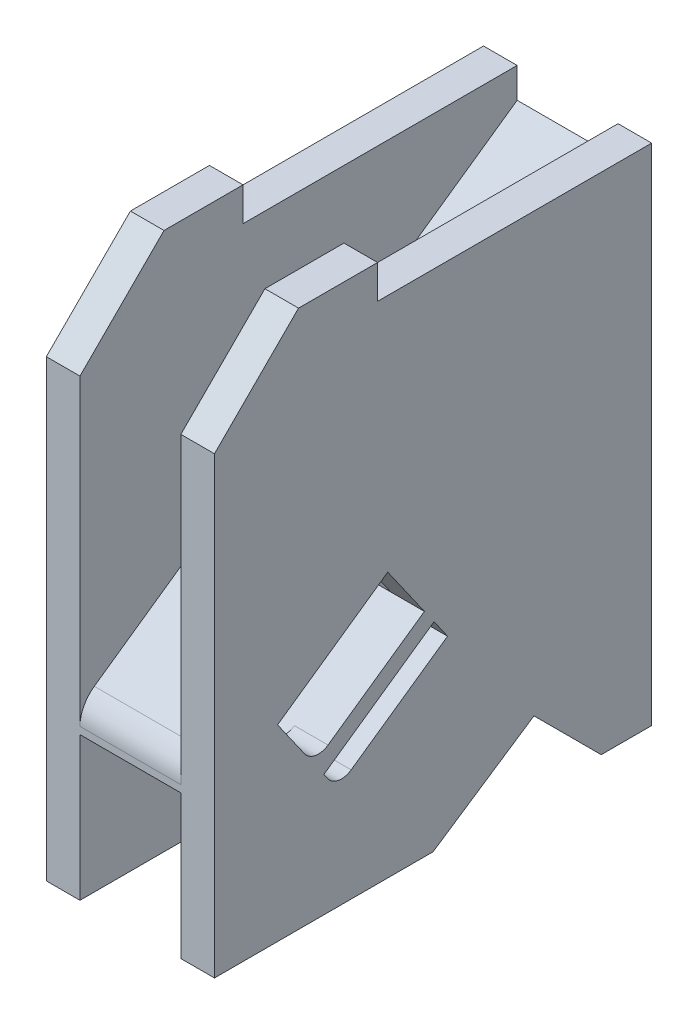
from build123d import *

# Parameters (mm, degrees)
SKETCH5_W           = 50.00000000000001
SKETCH5_H           = 130
BOSS_EXTRUDE1_DEPTH = 150
CUT_EXTRUDE1_START  = -25
CUT_EXTRUDE1_DEPTH  = 15
BOSS_EXTRUDE3_START = 30
BOSS_EXTRUDE3_DEPTH = 5
SKETCH10_R          = 8.750000000000018
CUT_EXTRUDE3_DEPTH  = 100
SKETCH18_W          = 48.5
SKETCH18_H          = 10
BOSS_EXTRUDE4_DEPTH = 10
BOSS_EXTRUDE5_START = 40
SKETCH18_2_W        = 48.5
SKETCH18_2_H        = 10
BOSS_EXTRUDE5_DEPTH = 10
CHAMFER1_SIZE       = 25
CUT_EXTRUDE5_DEPTH  = 70
FILLET1_R           = 5
CUT_EXTRUDE6_DEPTH  = 70
FILLET2_R           = 10


with BuildPart() as part:
    # Sketch5 → Boss-Extrude1 (new body)
    with BuildSketch(Plane(origin=(0, 0, 0), x_dir=(1, 0, 0), z_dir=(0, 1, 0))):
        with Locations((25.000000000000004, 65)):
            Rectangle(SKETCH5_W, SKETCH5_H)
    extrude(amount=BOSS_EXTRUDE1_DEPTH)

    # Sketch7 → Cut-Extrude1 (cut, symmetric)
    with BuildSketch(Plane(origin=(50, 0, 0), x_dir=(0, 0, -1), z_dir=(1, 0, 0)).offset(CUT_EXTRUDE1_START)):
        Polygon((0, 50), (129.99999999999997, 141.02697996726184), (130, 150), (0, 150), align=None)
        Polygon((130, 0), (130, 133.70233243469318), (0, 42.67535246743131), (0, 0), align=None)
    extrude(amount=CUT_EXTRUDE1_DEPTH, both=True, mode=Mode.SUBTRACT)

    # Sketch17 → Boss-Extrude3 (add)
    with BuildSketch(Plane(origin=(1.261e-14, 275.41205482615817, -321.9217767956235), x_dir=(1, 0, 0), z_dir=(0, -0.819152044288993, -0.5735764363510444)).offset(BOSS_EXTRUDE3_START)):
        Polygon((9.99999999999999, 374.2932281420449), (39.999999999999986, 374.2932281420449), (39.999999999999986, 334.2932281420449), (9.999999999999993, 334.2932281420449), align=None)
    extrude(amount=-BOSS_EXTRUDE3_DEPTH)

    # Sketch10 → Cut-Extrude3 (cut)
    with BuildSketch(Plane(origin=(0, 33.55050358314182, 23.492315519647676), x_dir=(1, 0, 0), z_dir=(0, 0.819152044288993, 0.5735764363510444))):
        with Locations((25, 68.17827312728308)):
            Circle(SKETCH10_R)
    extrude(amount=-CUT_EXTRUDE3_DEPTH, mode=Mode.SUBTRACT)

    # Sketch18 → Boss-Extrude4 (add)
    with BuildSketch(Plane(origin=(0, 0, 0), x_dir=(0, 0, -1), z_dir=(1, 0, 0))):
        with Locations((24.25, 155)):
            Rectangle(SKETCH18_W, SKETCH18_H)
    extrude(amount=BOSS_EXTRUDE4_DEPTH)

    # Sketch18<2> → Boss-Extrude5 (add)
    with BuildSketch(Plane(origin=(0, 0, 0), x_dir=(0, 0, -1), z_dir=(1, 0, 0)).offset(BOSS_EXTRUDE5_START)):
        with Locations((24.25, 155)):
            Rectangle(SKETCH18_2_W, SKETCH18_2_H)
    extrude(amount=BOSS_EXTRUDE5_DEPTH)

    # Chamfer1
    chamfer1_edges = [part.edges().sort_by_distance(p)[0] for p in [
        (5, 160, 0),
        (45, 160, 0),
    ]]
    chamfer(chamfer1_edges, length=CHAMFER1_SIZE)

    # Sketch21 → Cut-Extrude5 (cut)
    with BuildSketch(Plane(origin=(0, 0, 0), x_dir=(0, 0, -1), z_dir=(1, 0, 0))):
        Polygon((29.65812470831714, 40.2474777708908), (62.424206479876844, 63.19053522493257), (51.526254189207016, 78.75442406642354), (18.76017241764731, 55.81136661238177), align=None)
        Polygon((69.30712371608935, 53.36071069346464), (65.29208866163206, 59.0947750034876), (32.52600689007236, 36.15171754944583), (36.54104194452965, 30.417653239422872), align=None)
    extrude(amount=CUT_EXTRUDE5_DEPTH, mode=Mode.SUBTRACT)

    # Fillet1
    fillet1_edges = [part.edges().sort_by_distance(p)[0] for p in [
        (5, 30.417653239422872, -36.54104194452965),
        (45, 30.417653239422872, -36.54104194452965),
        (5.000000000000001, 40.2474777708908, -29.65812470831714),
        (45, 40.2474777708908, -29.65812470831714),
    ]]
    fillet(fillet1_edges, radius=FILLET1_R)

    # Sketch22 → Cut-Extrude6 (cut)
    with BuildSketch(Plane.ZY):
        Polygon((-115, 0), (-95, 20), (-65, 0), align=None)
    extrude(amount=-CUT_EXTRUDE6_DEPTH, mode=Mode.SUBTRACT)

    # Fillet2
    fillet2_edges = [part.edges().sort_by_distance(p)[0] for p in [
        (25, 50, 0),
    ]]
    fillet(fillet2_edges, radius=FILLET2_R)


solid = part.part
